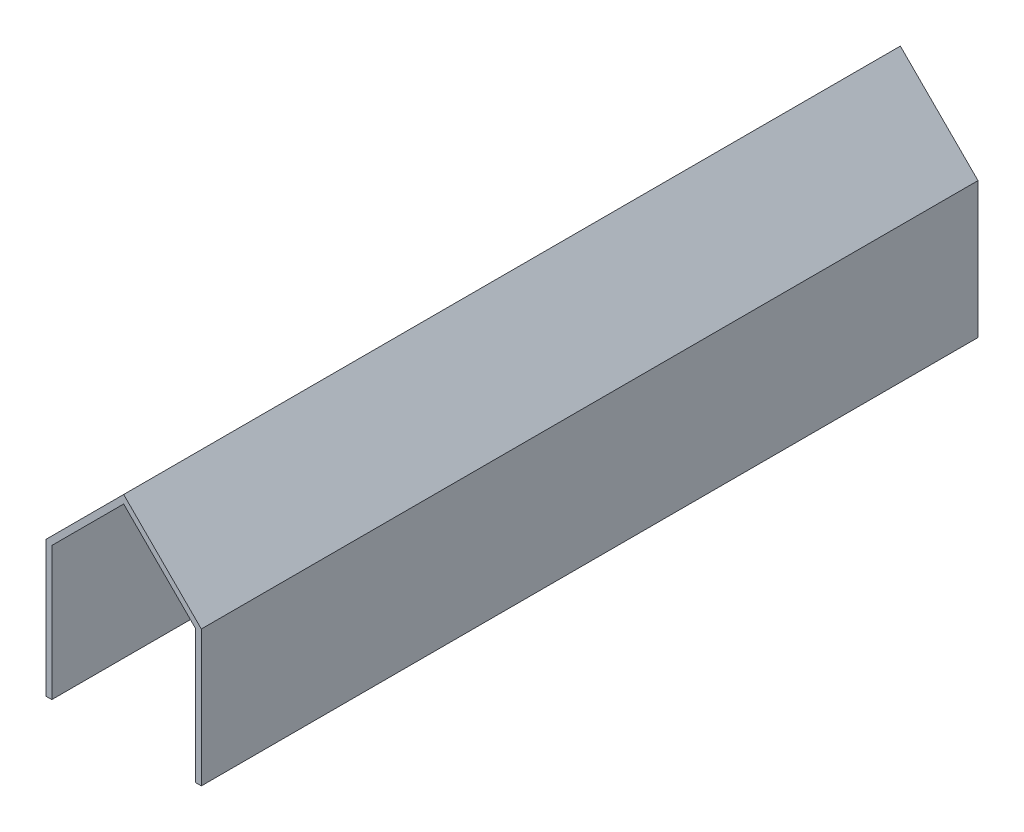
from build123d import *

# Parameters (mm, degrees)
BOSS_EXTRUDE1_DEPTH = 400


with BuildPart() as part:
    # Sketch1 → Boss-Extrude1 (new body)
    with BuildSketch(Plane.XY):
        Polygon((-37, 0), (-37, 68.757359313), (0, 105.757359313), (37, 68.757359313), (37, 0), (40, 0), (40, 70), (0, 110), (-40, 70), (-40, 0), align=None)
    extrude(amount=BOSS_EXTRUDE1_DEPTH)


solid = part.part
